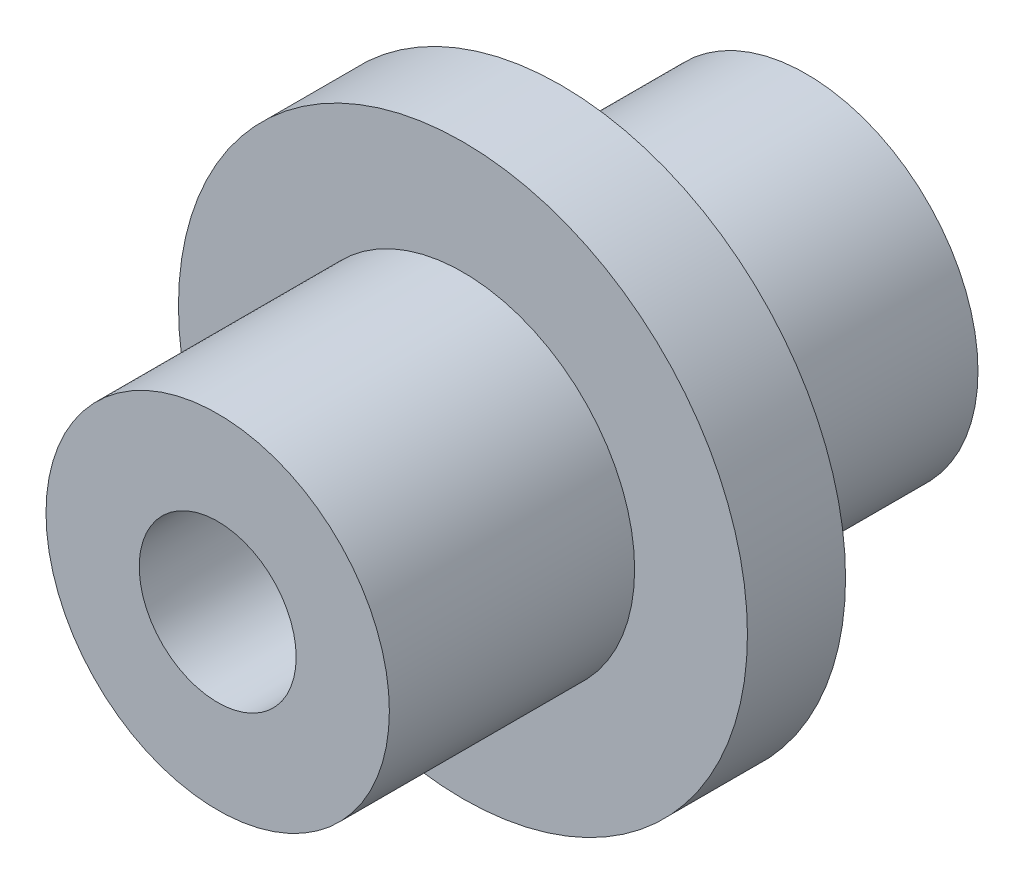
from build123d import *

# Parameters (mm, degrees)
SKETCH1_R                = 5.8
BOSS_EXTRUDE1_DEPTH      = 2
BOSS_EXTRUDE2_DEPTH      = 5
BOSS_EXTRUDE2_DEPTH_BACK = 7
SKETCH2_R                = 3.5
SKETCH8_R                = 1.6
SKETCH6_R                = 1.65


with BuildPart() as part:
    # Sketch1 → Boss-Extrude1 (new body)
    with BuildSketch(Plane.XY.offset(33)):
        Circle(SKETCH1_R)
    extrude(amount=-BOSS_EXTRUDE1_DEPTH)

    # Sketch2 → Boss-Extrude2 (add, two sides: drawn at the far end of the back side and taken through both)
    with BuildSketch(Plane.XY.offset(33).offset(-BOSS_EXTRUDE2_DEPTH_BACK)):
        Circle(SKETCH2_R)
    extrude(amount=BOSS_EXTRUDE2_DEPTH + BOSS_EXTRUDE2_DEPTH_BACK)

    # Sketch8 → Cut-Loft2 section 0
    with BuildSketch(Plane.XY.offset(38)):
        Circle(SKETCH8_R)
    # Sketch6 → Cut-Loft2 section 1
    with BuildSketch(Plane.XY.offset(26)):
        Circle(SKETCH6_R)
    loft(mode=Mode.SUBTRACT)


solid = part.part
